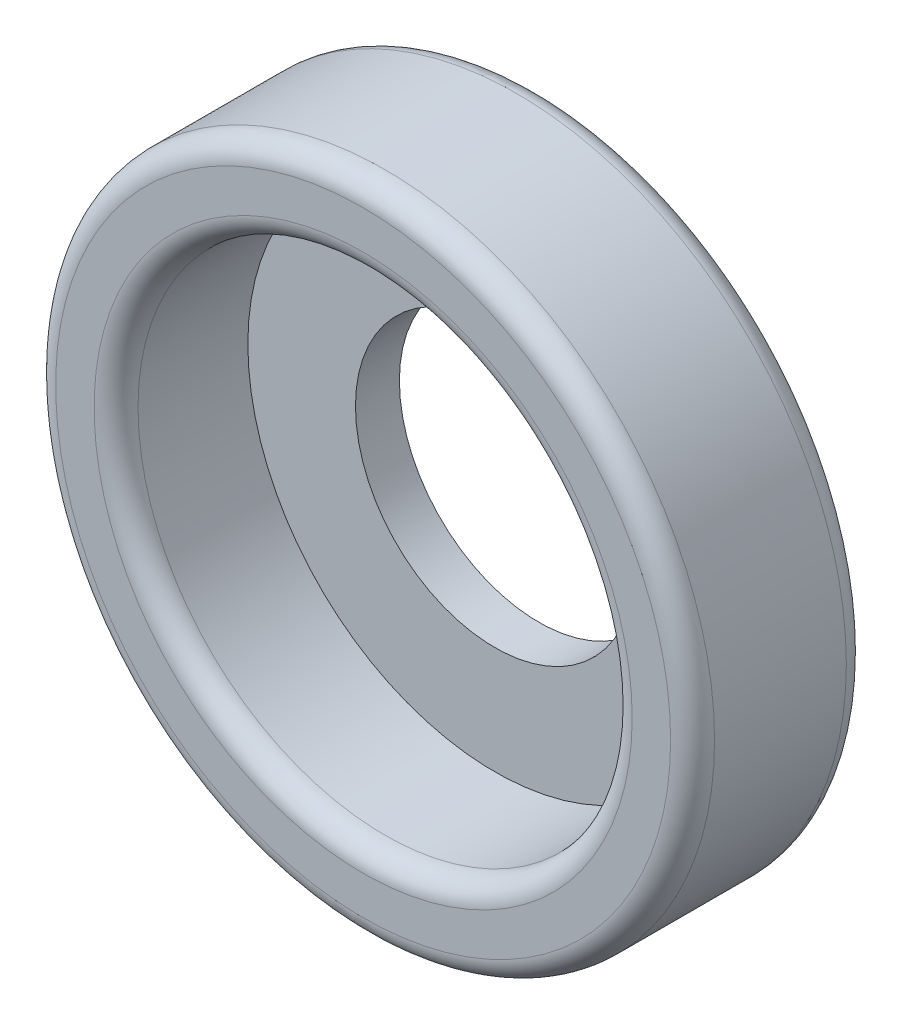
from build123d import *

# Parameters (mm, degrees)
SKETCH1_R           = 15
SKETCH1_R_2         = 11.25
BOSS_EXTRUDE1_DEPTH = 8
SKETCH1_3_R         = 11.25
SKETCH1_3_R_2       = 6.35
BOSS_EXTRUDE2_DEPTH = 2
FILLET1_R           = 1


with BuildPart() as part:
    # Sketch1 → Boss-Extrude1 (new body)
    with BuildSketch(Plane.XY):
        Circle(SKETCH1_R)
        Circle(SKETCH1_R_2, mode=Mode.SUBTRACT)
    extrude(amount=BOSS_EXTRUDE1_DEPTH)

    # Sketch1<3> → Boss-Extrude2 (add)
    with BuildSketch(Plane.XY):
        Circle(SKETCH1_3_R)
        Circle(SKETCH1_3_R_2, mode=Mode.SUBTRACT)
    extrude(amount=BOSS_EXTRUDE2_DEPTH)

    # Fillet1
    fillet1_edges = [part.edges().sort_by_distance(p)[0] for p in [
        (-11.25, 0, 8),
        (-15, 0, 8),
        (-15, 0, 0),
    ]]
    fillet(fillet1_edges, radius=FILLET1_R)


solid = part.part
